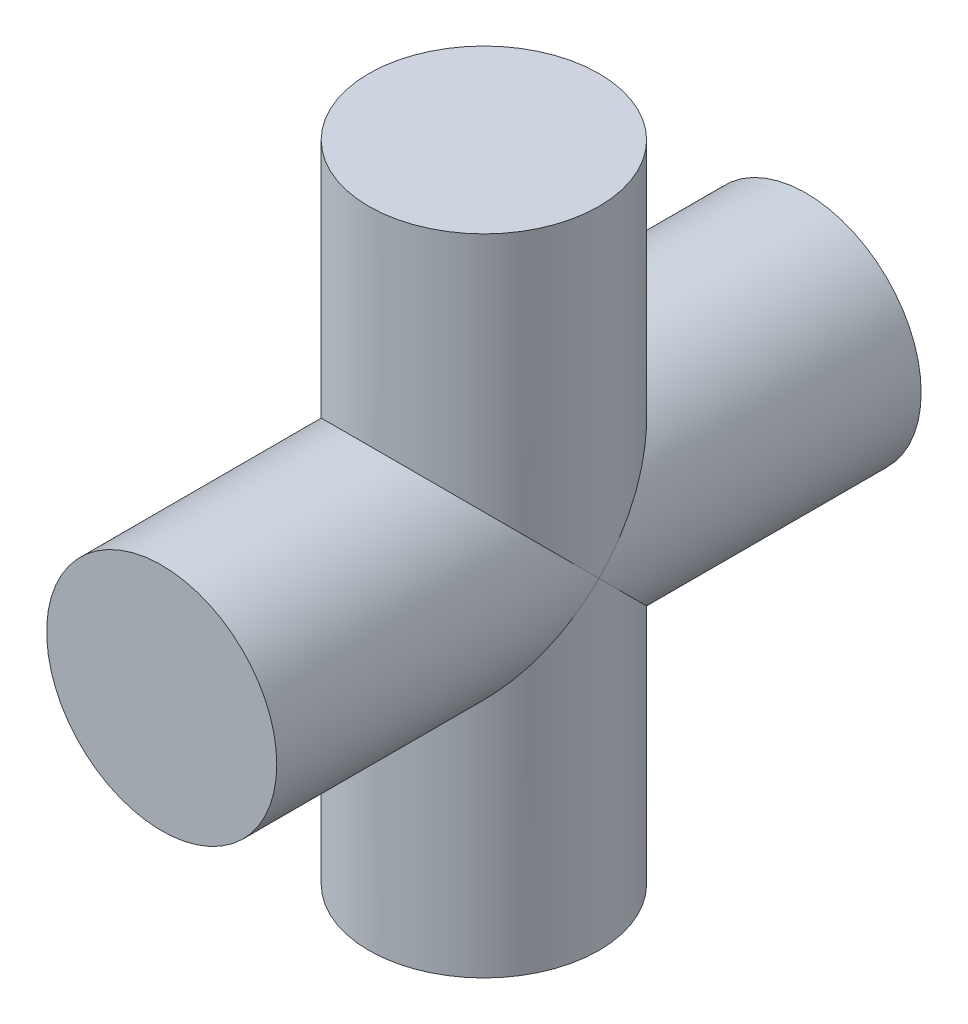
from build123d import *

# Parameters (mm, degrees)
DODANIE_WYCI_GNI_CIE1_DEPTH      = 21
DODANIE_WYCI_GNI_CIE1_DEPTH_BACK = 21
SZKIC1_R                         = 7.5
DODANIE_WYCI_GNI_CIE2_DEPTH      = 21
DODANIE_WYCI_GNI_CIE2_DEPTH_BACK = 21
SZKIC2_R                         = 7.5


with BuildPart() as part:
    # Szkic1 → Dodanie-wyciągnięcie1 (new, two sides: drawn at the far end of the back side and taken through both)
    with BuildSketch(Plane.XY.offset(-DODANIE_WYCI_GNI_CIE1_DEPTH_BACK)):
        Circle(SZKIC1_R)
    extrude(amount=DODANIE_WYCI_GNI_CIE1_DEPTH + DODANIE_WYCI_GNI_CIE1_DEPTH_BACK)

    # Szkic2 → Dodanie-wyciągnięcie2 (add, two sides: drawn at the far end of the back side and taken through both)
    with BuildSketch(Plane(origin=(0, 0, 0), x_dir=(1, 0, 0), z_dir=(0, 1, 0)).offset(-DODANIE_WYCI_GNI_CIE2_DEPTH_BACK)):
        Circle(SZKIC2_R)
    extrude(amount=DODANIE_WYCI_GNI_CIE2_DEPTH + DODANIE_WYCI_GNI_CIE2_DEPTH_BACK)


solid = part.part
